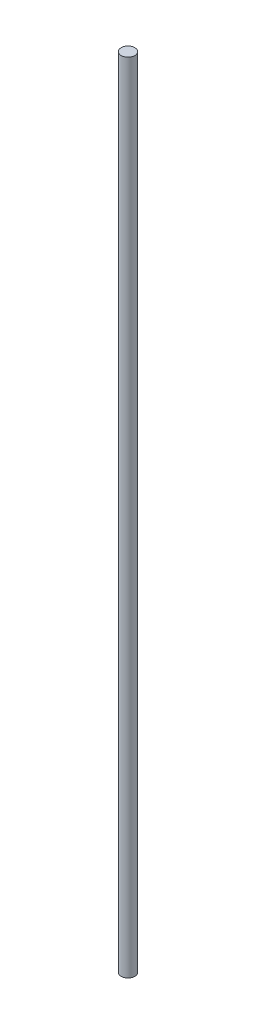
from build123d import *

# Parameters (mm, degrees)
SKETCH_1_R      = 6
EXTRUDE_1_DEPTH = 700


with BuildPart() as part:
    # 草图1 → 凸台-拉伸1 (new body)
    with BuildSketch(Plane(origin=(0, 0, 0), x_dir=(1, 0, 0), z_dir=(0, 1, 0))):
        with Locations(Location((0, 0, 0), (0, 0, 270))):
            Circle(SKETCH_1_R)
    extrude(amount=EXTRUDE_1_DEPTH)


solid = part.part
